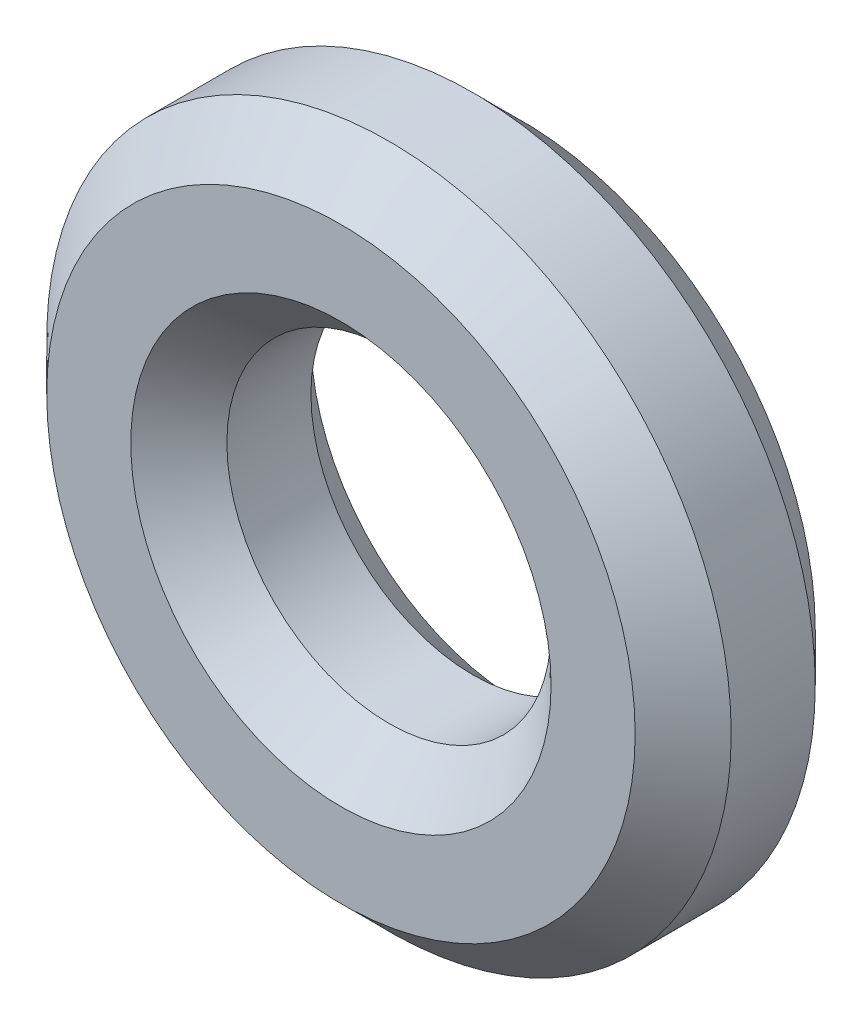
from build123d import *

# Parameters (mm, degrees)
ESBO_O1_R                = 5.7
ESBO_O1_R_2              = 2.7
RESSALTO_EXTRUS_O1_DEPTH = 3
CHANFRO1_SIZE            = 0.8


with BuildPart() as part:
    # Esboço1 → Ressalto-extrusão1 (new body)
    with BuildSketch(Plane.XY):
        Circle(ESBO_O1_R)
        Circle(ESBO_O1_R_2, mode=Mode.SUBTRACT)
    extrude(amount=RESSALTO_EXTRUS_O1_DEPTH)

    # Chanfro1
    chanfro1_edges = [part.edges().sort_by_distance(p)[0] for p in [
        (-5.7, 0, 0),
        (-5.7, 0, 3),
        (-2.7, 0, 0),
        (-2.7, 0, 3),
    ]]
    chamfer(chanfro1_edges, length=CHANFRO1_SIZE)


solid = part.part
